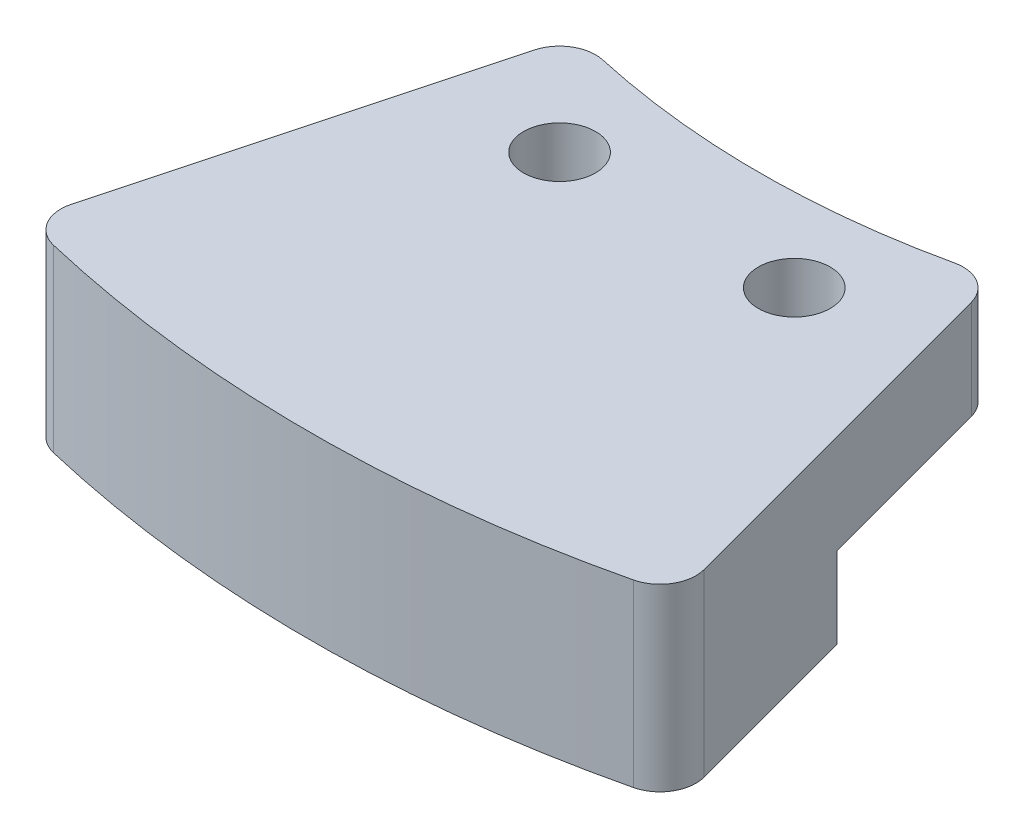
from build123d import *

# Parameters (mm, degrees)
SKETCH_1_R          = 2
EXTRUDE_1_DEPTH     = 10
CUT_EXTRUDE_1_DEPTH = 4.5
FILLET_1_R          = 2


with BuildPart() as part:
    # ｽｹｯﾁ1 → ﾎﾞｽ - 押し出し1 (new body)
    with BuildSketch(Plane(origin=(0, 0, 0), x_dir=(1, 0, 0), z_dir=(0, 1, 0))):
        with BuildLine():
            Line((-11.64685703, -43.466662183), (-18.117333157, -67.61480784))
            ThreePointArc((-18.117333157, -67.61480784), (0, -70), (18.117333157, -67.61480784))
            Line((18.117333157, -67.61480784), (11.64685703, -43.466662183))
            ThreePointArc((11.64685703, -43.466662183), (0, -45), (-11.64685703, -43.466662183))
        make_face()
        with Locations(Location((-6.526309611, -49.572243069, 0), (0, 0, 270))):
            Circle(SKETCH_1_R, mode=Mode.SUBTRACT)
        with Locations(Location((6.526309611, -49.572243069, 0), (0, 0, 90))):
            Circle(SKETCH_1_R, mode=Mode.SUBTRACT)
    extrude(amount=EXTRUDE_1_DEPTH)

    # ｽｹｯﾁ2 → ｶｯﾄ - 押し出し1 (cut)
    with BuildSketch(Plane.XZ):
        with BuildLine():
            Line((14.882095093, 55.540735012), (11.64685703, 43.466662183))
            ThreePointArc((11.64685703, 43.466662183), (0, 45), (-11.64685703, 43.466662183))
            Line((-11.64685703, 43.466662183), (-14.882095093, 55.540735012))
            ThreePointArc((-14.882095093, 55.540735012), (0, 57.5), (14.882095093, 55.540735012))
        make_face()
    extrude(amount=-CUT_EXTRUDE_1_DEPTH, mode=Mode.SUBTRACT)

    # ﾌｨﾚｯﾄ1
    fillet_1_edges = [part.edges().sort_by_distance(p)[0] for p in [
        (-18.117333157, 5, 67.61480784),
        (-11.64685703, 7.25, 43.466662183),
        (11.64685703, 7.25, 43.466662183),
        (18.117333157, 5, 67.61480784),
    ]]
    fillet(fillet_1_edges, radius=FILLET_1_R)


solid = part.part
